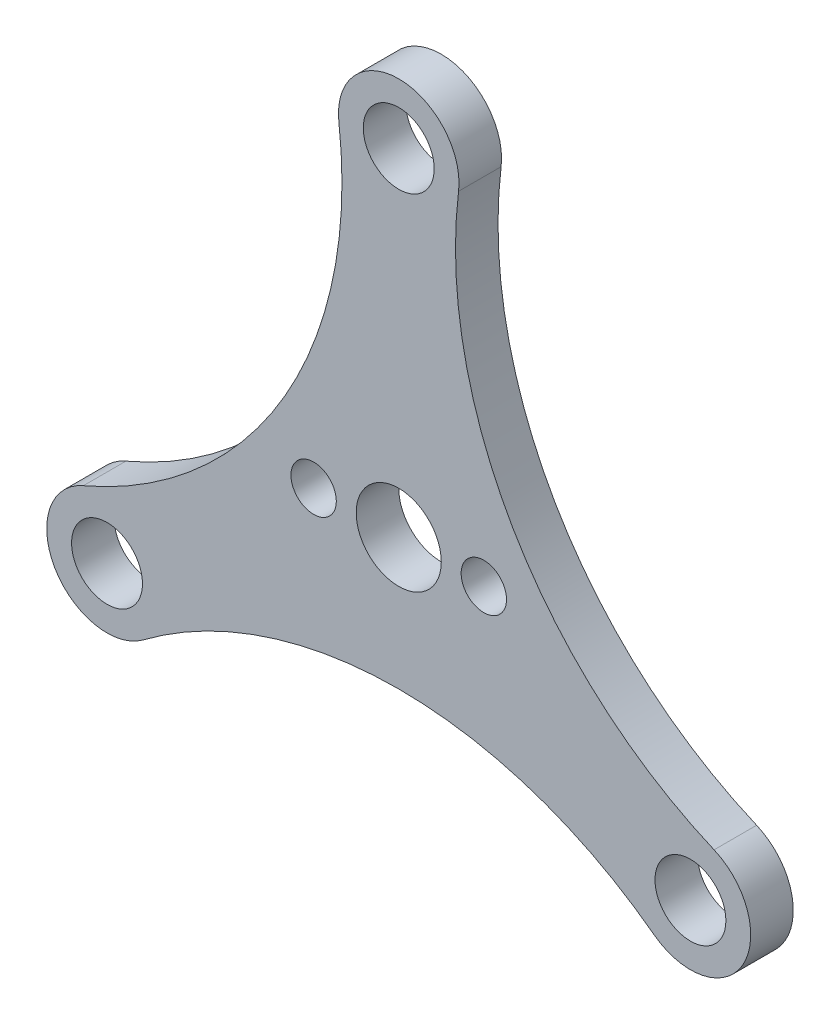
from build123d import *

# Parameters (mm, degrees)
SKETCH_1_R      = 2.5
SKETCH_1_R_2    = 3
SKETCH_1_R_3    = 1.6
EXTRUDE_1_DEPTH = 3


with BuildPart() as part:
    # ｽｹｯﾁ1 → ﾎﾞｽ - 押し出し1 (new body)
    with BuildSketch(Plane.XY):
        with BuildLine():
            ThreePointArc((-22.235006429, -7.965532761), (-24.248711306, -14), (-18.01585694, -15.27331404))
            ThreePointArc((-18.01585694, -15.27331404), (0, -9.261413146), (18.01585694, -15.27331404))
            ThreePointArc((18.01585694, -15.27331404), (24.248711306, -14), (22.235006429, -7.965532761))
            ThreePointArc((22.235006429, -7.965532761), (8.020619059, 4.630706573), (4.219149489, 23.238846801))
            ThreePointArc((4.219149489, 23.238846801), (0, 28), (-4.219149489, 23.238846801))
            ThreePointArc((-4.219149489, 23.238846801), (-8.020619059, 4.630706573), (-22.235006429, -7.965532761))
        make_face()
        with Locations((0, 23.75)):
            Circle(SKETCH_1_R, mode=Mode.SUBTRACT)
        Circle(SKETCH_1_R_2, mode=Mode.SUBTRACT)
        with Locations((-6, 0)):
            Circle(SKETCH_1_R_3, mode=Mode.SUBTRACT)
        with Locations((6, 0)):
            Circle(SKETCH_1_R_3, mode=Mode.SUBTRACT)
        with Locations((20.56810334, -11.875)):
            Circle(SKETCH_1_R, mode=Mode.SUBTRACT)
        with Locations((-20.56810334, -11.875)):
            Circle(SKETCH_1_R, mode=Mode.SUBTRACT)
    extrude(amount=EXTRUDE_1_DEPTH)


solid = part.part
